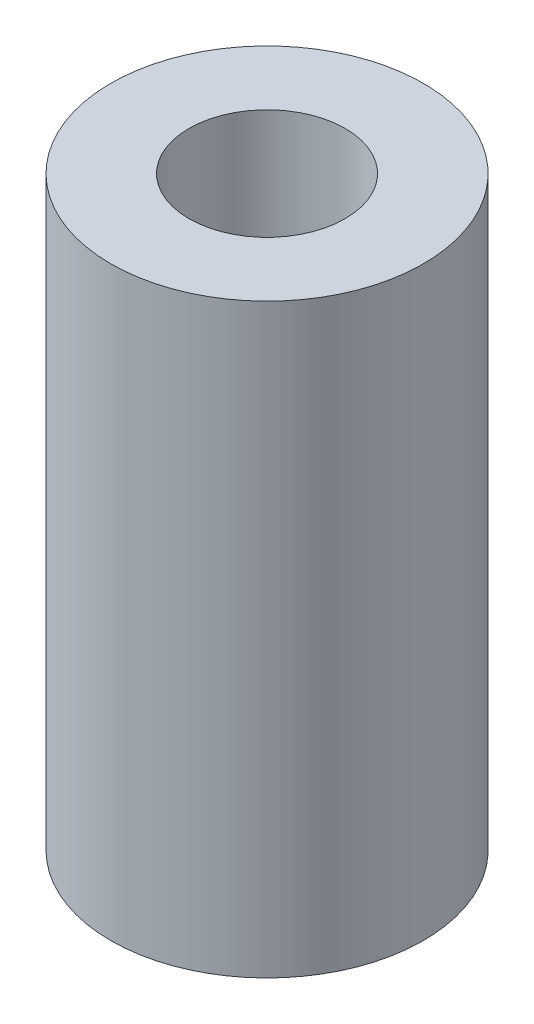
from build123d import *

# Parameters (mm, degrees)
SKETCH1_R           = 4
BOSS_EXTRUDE1_DEPTH = 15
CUT_EXTRUDE1_REACH  = 18.031
SKETCH2_R           = 2


with BuildPart() as part:
    # Sketch1 → Boss-Extrude1 (new body)
    with BuildSketch(Plane(origin=(0, 0, 0), x_dir=(1, 0, 0), z_dir=(0, 1, 0))):
        with Locations(Location((0, 0, 0), (0, 0, 270))):
            Circle(SKETCH1_R)
    extrude(amount=BOSS_EXTRUDE1_DEPTH)

    # Sketch2 → Cut-Extrude1 (cut, up to next)
    with BuildSketch(Plane(origin=(0, 15, 0), x_dir=(1, 0, 0), z_dir=(0, 1, 0)), mode=Mode.PRIVATE) as cut_extrude1_sk1:
        with Locations(Location((0, 0, 0), (0, 0, 270))):
            Circle(SKETCH2_R)
    cut_extrude1_tool1 = extrude(cut_extrude1_sk1.sketch, amount=-CUT_EXTRUDE1_REACH, mode=Mode.PRIVATE) & part.part
    add(cut_extrude1_tool1.solids().sort_by_distance((0, 15, 0))[0], mode=Mode.SUBTRACT)


solid = part.part
